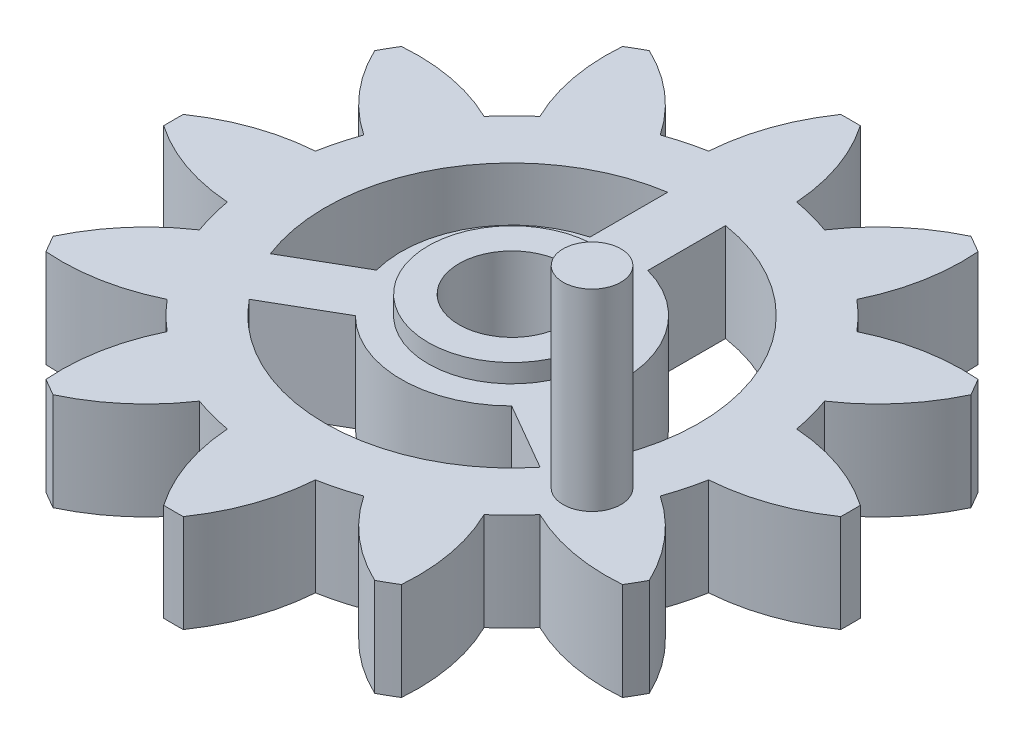
from build123d import *

# Parameters (mm, degrees)
BASE_PROFILE_R          = 12.7
GEAR_BASE_DEPTH         = 2.54
GEAR_START              = 2.54
GEAR_TOOTH_DEPTH        = 5.08
PATTERN_TOOTH_12T_COUNT = 12
LIP_PROFILE_R           = 4.348362351
LIP_DEPTH               = 3.5
SHAFT_START             = 0.96
HOLE_PROFILE_R          = 2.75
SHAFT_HOLE_DEPTH        = 7
GEAR_CUTOUT_DEPTH       = 5.08
HANDLE_PROFILE_R        = 1.5
HANDLE_DEPTH            = 10


with BuildPart() as part:
    # Base Profile → Gear Base (new, symmetric)
    with BuildSketch(Plane(origin=(0, 0, 0), x_dir=(1, 0, 0), z_dir=(0, 1, 0))):
        with Locations(Location((0, 0, 0), (0, 0, 270))):
            Circle(BASE_PROFILE_R)
    extrude(amount=GEAR_BASE_DEPTH, both=True)

    # Tooth Profile → Gear Tooth (add)
    with BuildSketch(Plane(origin=(0, 0, 0), x_dir=(1, 0, 0), z_dir=(0, 1, 0)).offset(GEAR_START)):
        with BuildLine():
            ThreePointArc((-2.286, 12.492565949), (-1.739501602, 15.15244151), (-0.508, 17.572565949))
            ThreePointArc((-0.508, 17.572565949), (0, 17.576799577), (0.508, 17.572565949))
            ThreePointArc((0.508, 17.572565949), (1.739501602, 15.15244151), (2.286, 12.492565949))
            ThreePointArc((2.286, 12.492565949), (0, 12.7), (-2.286, 12.492565949))
        make_face()
    gear_tooth = extrude(amount=-GEAR_TOOTH_DEPTH)

    # Pattern Tooth (12T): Gear Tooth ×12 about axis
    pattern_tooth_12t_axis = Axis((0, 0, 0), (0, 1, 0))
    for i in range(1, PATTERN_TOOTH_12T_COUNT):
        add(gear_tooth.rotate(pattern_tooth_12t_axis, i * 360 / PATTERN_TOOTH_12T_COUNT))

    # Lip Profile → Lip (add, symmetric)
    with BuildSketch(Plane(origin=(0, 0, 0), x_dir=(1, 0, 0), z_dir=(0, 1, 0))):
        with Locations(Location((0, 0, 0), (0, 0, 270))):
            Circle(LIP_PROFILE_R)
    extrude(amount=LIP_DEPTH, both=True)

    # Hole Profile → Shaft Hole (cut)
    with BuildSketch(Plane(origin=(0, 2.54, 0), x_dir=(1, 0, 0), z_dir=(0, 1, 0)).offset(SHAFT_START)):
        with Locations(Location((0, 0, 0), (0, 0, 270))):
            Circle(HOLE_PROFILE_R)
    extrude(amount=-SHAFT_HOLE_DEPTH, mode=Mode.SUBTRACT)

    # Cutout Profile → Gear Cutout (cut)
    with BuildSketch(Plane(origin=(0, 2.54, 0), x_dir=(1, 0, 0), z_dir=(0, 1, 0))):
        with BuildLine():
            Line((-1.5, 9.583318841), (-1.5, 5.550900828))
            ThreePointArc((-1.5, 5.550900828), (-4.979646072, 2.875), (-5.557221131, -1.476412308))
            Line((-5.557221131, -1.476412308), (-9.049397568, -3.492621315))
            ThreePointArc((-9.049397568, -3.492621315), (-8.400446417, 4.85), (-1.5, 9.583318841))
        make_face()
        with BuildLine():
            Line((1.5, 9.583318841), (1.5, 5.550900828))
            ThreePointArc((1.5, 5.550900828), (4.979646072, 2.875), (5.557221131, -1.476412308))
            Line((5.557221131, -1.476412308), (9.049397568, -3.492621315))
            ThreePointArc((9.049397568, -3.492621315), (8.400446417, 4.85), (1.5, 9.583318841))
        make_face()
        with BuildLine():
            Line((7.549397568, -6.090697526), (4.057221131, -4.07448852))
            ThreePointArc((4.057221131, -4.07448852), (0, -5.75), (-4.057221131, -4.07448852))
            Line((-4.057221131, -4.07448852), (-7.549397568, -6.090697526))
            ThreePointArc((-7.549397568, -6.090697526), (0, -9.7), (7.549397568, -6.090697526))
        make_face()
    extrude(amount=-GEAR_CUTOUT_DEPTH, mode=Mode.SUBTRACT)

    # Handle Profile → Handle (add)
    with BuildSketch(Plane(origin=(0, 2.54, 0), x_dir=(1, 0, 0), z_dir=(0, 1, 0))):
        with Locations(Location((9.830168473, -5.675450414, 0), (0, 0, 270))):
            Circle(HANDLE_PROFILE_R)
    extrude(amount=HANDLE_DEPTH)


solid = part.part
